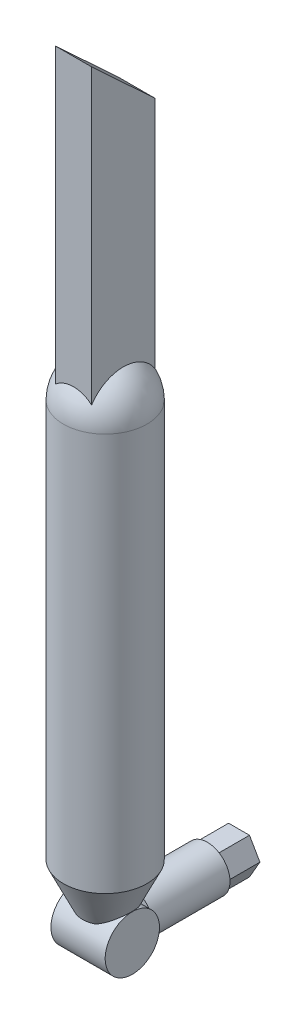
from build123d import *

# Parameters (mm, degrees)
SMA_NUT_DEPTH        = 7
SKETCH2_R            = 3.175
SMA_BORE_DEPTH       = 5
SKETCH3_R            = 5
SLEEVE_DEPTH         = 17
SKETCH4_R            = 6
SWIVEL_KNUCKLE_DEPTH = 6
WHIP_BLADE_DEPTH     = 4


with BuildPart() as part:
    # Sketch1 → SMA_Nut (new body)
    with BuildSketch(Plane.XY):
        Polygon((4.618802154, 0), (2.309401077, 4), (-2.309401077, 4), (-4.618802154, 0), (-2.309401077, -4), (2.309401077, -4), align=None)
    extrude(amount=SMA_NUT_DEPTH)

    # Sketch2 → SMA_Bore (cut)
    with BuildSketch(Plane.XY):
        Circle(SKETCH2_R)
    extrude(amount=SMA_BORE_DEPTH, mode=Mode.SUBTRACT)


with BuildPart() as body_2:
    # Sketch3 → Sleeve (new body)
    with BuildSketch(Plane.XY.offset(7)):
        Circle(SKETCH3_R)
    extrude(amount=SLEEVE_DEPTH)

    # Sketch4 → Swivel_Knuckle (add, symmetric)
    with BuildSketch(Plane(origin=(0, 0, 0), x_dir=(0, 0, -1), z_dir=(1, 0, 0))):
        with Locations((-29.6, 0)):
            Circle(SKETCH4_R)
    extrude(amount=SWIVEL_KNUCKLE_DEPTH, both=True)

    # Sketch5 → Radome_Boot (revolve)
    with BuildSketch(Plane(origin=(0, 0, 0), x_dir=(0, 0, -1), z_dir=(1, 0, 0)), mode=Mode.PRIVATE) as radome_boot_sk:
        with BuildLine():
            Line((-29.6, 4), (-34.6, 4))
            Line((-34.6, 4), (-38.85, 13))
            Line((-38.85, 13), (-38.85, 101))
            ThreePointArc((-38.85, 101), (-36.140737726, 107.540737726), (-29.6, 110.25))
            Line((-29.6, 110.25), (-29.6, 4))
        make_face()
    revolve(radome_boot_sk.sketch.rotate(Axis((0, 2, 29.6), (0, 1, 0)), 333.434949116), axis=Axis((0, 2, 29.6), (0, 1, 0)))

    # Sketch6 → Whip_Blade (add, symmetric)
    with BuildSketch(Plane(origin=(0, 0, 0), x_dir=(0, 0, -1), z_dir=(1, 0, 0))):
        Polygon((-22.6, 95), (-36.6, 95), (-36.6, 170.3), (-22.6, 157.3), align=None)
    extrude(amount=WHIP_BLADE_DEPTH, both=True)


solid = Compound([part.part, body_2.part])
